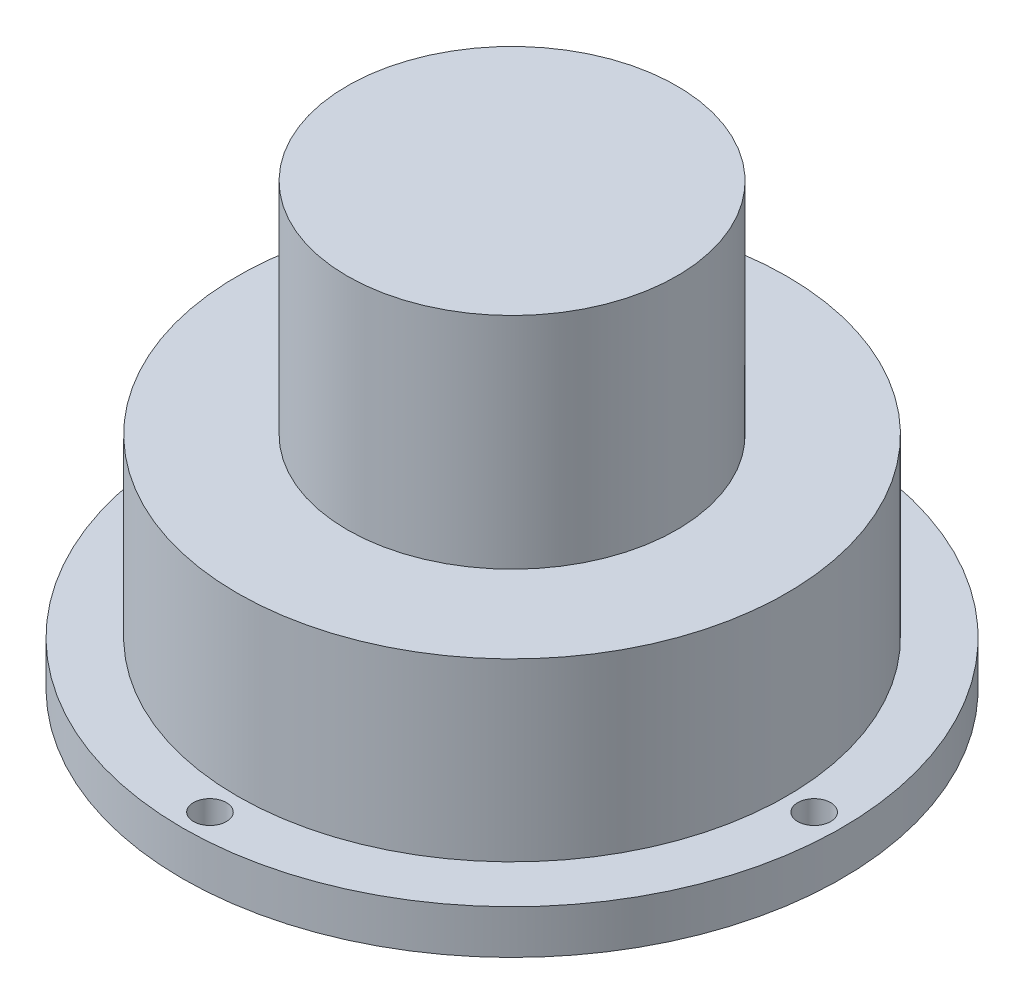
from build123d import *

# Parameters (mm, degrees)
SKETCH1_R                  = 150
SKETCH1_R_2                = 125
BOSS_EXTRUDE1_DEPTH        = 20
SKETCH1_2_R                = 125
BOSS_EXTRUDE2_DEPTH        = 100
SKETCH2_R                  = 75
BOSS_EXTRUDE3_DEPTH        = 100
F_15_0_15_DIAMETER_HOLE1_D = 15
CIRPATTERN1_COUNT          = 4


with BuildPart() as part:
    # Sketch1 → Boss-Extrude1 (new body)
    with BuildSketch(Plane(origin=(0, 0, 0), x_dir=(1, 0, 0), z_dir=(0, 1, 0))):
        Circle(SKETCH1_R)
        Circle(SKETCH1_R_2, mode=Mode.SUBTRACT)
    extrude(amount=BOSS_EXTRUDE1_DEPTH)

    # Sketch1<2> → Boss-Extrude2 (add)
    with BuildSketch(Plane(origin=(0, 0, 0), x_dir=(1, 0, 0), z_dir=(0, 1, 0))):
        Circle(SKETCH1_2_R)
    extrude(amount=BOSS_EXTRUDE2_DEPTH)

    # Sketch2 → Boss-Extrude3 (add)
    with BuildSketch(Plane(origin=(0, 100, 0), x_dir=(1, 0, 0), z_dir=(0, 1, 0))):
        Circle(SKETCH2_R)
    extrude(amount=BOSS_EXTRUDE3_DEPTH)

    # Ø15.0 (15) Diameter Hole1 (through all)
    with Locations(Plane(origin=(0, 20, 0), x_dir=(1, 0, 0), z_dir=(0, 1, 0))):
        with Locations((137.5, 0)):
            f_15_0_15_diameter_hole1 = Hole(F_15_0_15_DIAMETER_HOLE1_D / 2)

    # CirPattern1: Ø15.0 (15) Diameter Hole1 ×4 about axis
    cirpattern1_axis = Axis((0, 100, 0), (0, -1, 0))
    for i in range(1, CIRPATTERN1_COUNT):
        add(f_15_0_15_diameter_hole1.rotate(cirpattern1_axis, i * 360 / CIRPATTERN1_COUNT), mode=Mode.SUBTRACT)


solid = part.part
